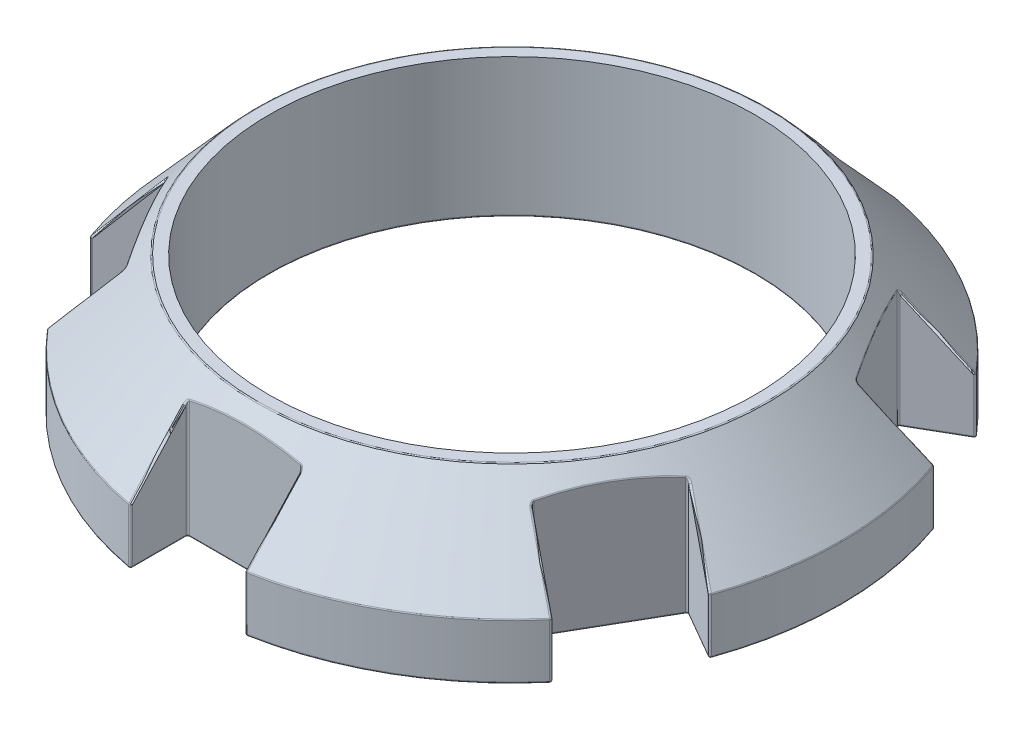
from build123d import *

# Parameters (mm, degrees)
SKETCH1_R           = 9.5
SKETCH1_R_2         = 7
BOSS_EXTRUDE1_DEPTH = 4
SKETCH5_W           = 3.3
SKETCH5_H           = 1.8
CUT_EXTRUDE1_DEPTH  = 15.017845769
CIRPATTERN1_COUNT   = 6
FILLET1_R           = 0.05


with BuildPart() as part:
    # Sketch1 → Boss-Extrude1 (new body)
    with BuildSketch(Plane(origin=(0, 0, 0), x_dir=(1, 0, 0), z_dir=(0, 1, 0))):
        with Locations(Location((0, 0, 0), (0, 0, 270))):
            Circle(SKETCH1_R)
        with Locations(Location((0, 0, 0), (0, 0, 270))):
            Circle(SKETCH1_R_2, mode=Mode.SUBTRACT)
    extrude(amount=BOSS_EXTRUDE1_DEPTH)

    # Sketch4 → Cut-Revolve1 (revolve, cut)
    with BuildSketch(Plane(origin=(0, 0, 0), x_dir=(0, 0, -1), z_dir=(1, 0, 0)), mode=Mode.PRIVATE) as cut_revolve1_sk:
        Polygon((7.35, 4), (9.5, 1.6), (9.5, 4), align=None)
    revolve(cut_revolve1_sk.sketch.rotate(Axis((0, 4, 0), (0, -1, 0)), 180), axis=Axis((0, 4, 0), (0, -1, 0)), mode=Mode.SUBTRACT)

    # Sketch5 → Cut-Extrude1 (cut, through all)
    with BuildSketch(Plane.XZ):
        with Locations((0, 8.6)):
            Rectangle(SKETCH5_W, SKETCH5_H)
    cut_extrude1 = extrude(amount=-CUT_EXTRUDE1_DEPTH, mode=Mode.SUBTRACT)

    # CirPattern1: Cut-Extrude1 ×6 about axis
    cirpattern1_axis = Axis((0, 0, 0), (0, 1, 0))
    for i in range(1, CIRPATTERN1_COUNT):
        add(cut_extrude1.rotate(cirpattern1_axis, i * 360 / CIRPATTERN1_COUNT), mode=Mode.SUBTRACT)

    # Fillet1
    fillet1_edges = [part.edges().sort_by_distance(p)[0] for p in [
        (4.75, 0, -8.227241336),
        (6.560297192, 0, -5.692845238),
        (8.210297192, 0, -2.834961406),
        (6.668395609, 0, -3.85),
        (8.927198776, 0.8, -3.248864728),
        (7.493395609, 1.707087488, -2.421058084),
        (7.277198776, 0.8, -6.10674856),
        (5.843395609, 1.707087488, -5.278941916),
        (0, 4, -7.35),
        (9.5, 1.6, 0),
        (6.668395609, 3.609302326, 3.85),
        (8.210988269, 2.507815792, 2.835360399),
        (6.560988269, 2.507815792, 5.693244232),
        (9.5, 0, 0),
        (8.210297192, 0, 2.834961406),
        (6.560297192, 0, 5.692845238),
        (6.668395609, 0, 3.85),
        (7.277198776, 0.8, 6.10674856),
        (5.843395609, 1.707087488, 5.278941916),
        (8.927198776, 0.8, 3.248864728),
        (7.493395609, 1.707087488, 2.421058084),
        (4.75, 1.6, 8.227241336),
        (-0.830606394, 3.559438603, 7.7),
        (1.65, 2.507815792, 8.528604631),
        (-1.65, 2.507815792, 8.528604631),
        (4.75, 0, 8.227241336),
        (1.65, 0, 8.527806644),
        (-1.65, 0, 8.527806644),
        (0, 0, 7.7),
        (-1.65, 0.8, 9.355613288),
        (-1.65, 1.707087488, 7.7),
        (1.65, 0.8, 9.355613288),
        (1.65, 1.707087488, 7.7),
        (-4.75, 1.6, 8.227241336),
        (-6.668395609, 3.609302326, 3.85),
        (-6.560988269, 2.507815792, 5.693244232),
        (-8.210988269, 2.507815792, 2.835360399),
        (-4.75, 0, 8.227241336),
        (-6.560297192, 0, 5.692845238),
        (-8.210297192, 0, 2.834961406),
        (-6.668395609, 0, 3.85),
        (-8.927198776, 0.8, 3.248864728),
        (-7.493395609, 1.707087488, 2.421058084),
        (-7.277198776, 0.8, 6.10674856),
        (-5.843395609, 1.707087488, 5.278941916),
        (0, 0, -7),
        (-9.5, 1.6, 0),
        (-6.668395609, 3.609302326, -3.85),
        (-8.210988269, 2.507815792, -2.835360399),
        (-6.560988269, 2.507815792, -5.693244232),
        (-9.5, 0, 0),
        (-8.210297192, 0, -2.834961406),
        (-6.560297192, 0, -5.692845238),
        (-6.668395609, 0, -3.85),
        (-7.277198776, 0.8, -6.10674856),
        (-5.843395609, 1.707087488, -5.278941916),
        (-8.927198776, 0.8, -3.248864728),
        (-7.493395609, 1.707087488, -2.421058084),
        (-4.75, 1.6, -8.227241336),
        (0, 3.609302326, -7.7),
        (-1.65, 2.507815792, -8.528604631),
        (1.65, 2.507815792, -8.528604631),
        (-4.75, 0, -8.227241336),
        (1.65, 0, -8.527806644),
        (0, 0, -7.7),
        (-1.65, 0, -8.527806644),
        (1.65, 0.8, -9.355613288),
        (1.65, 1.707087488, -7.7),
        (-1.65, 0.8, -9.355613288),
        (-1.65, 1.707087488, -7.7),
        (4.75, 1.6, -8.227241336),
        (6.668395609, 3.609302326, -3.85),
        (6.560988269, 2.507815792, -5.693244232),
        (8.210988269, 2.507815792, -2.835360399),
    ]]
    fillet(fillet1_edges, radius=FILLET1_R)


solid = part.part
